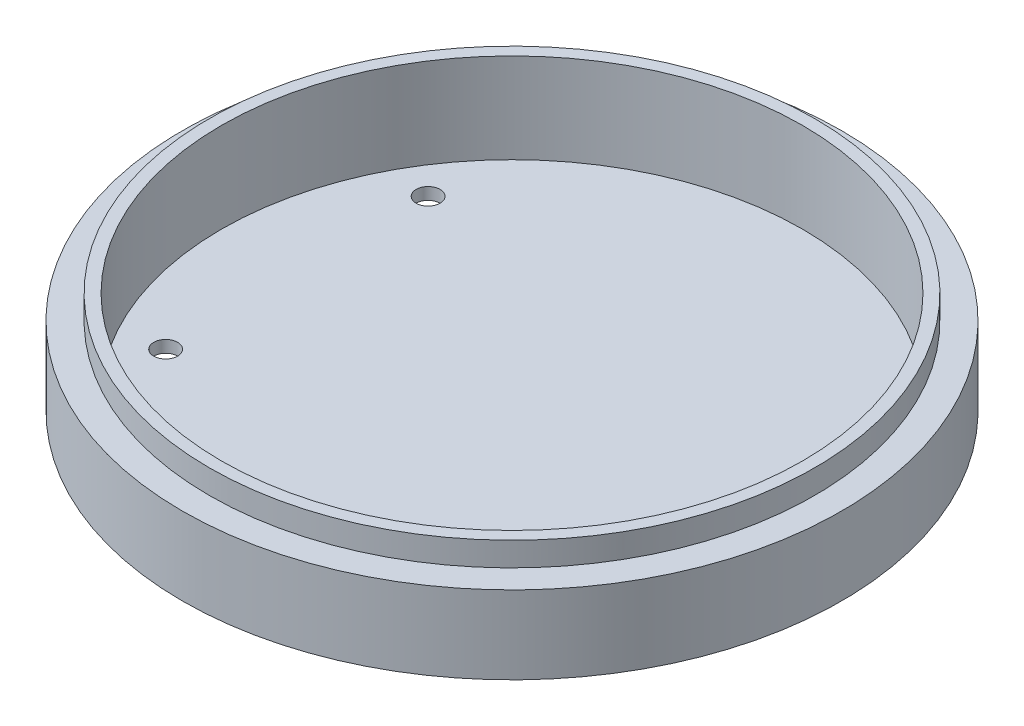
from build123d import *

# Parameters (mm, degrees)
SKETCH2_R           = 55
BOSS_EXTRUDE2_DEPTH = 13
SKETCH7_R           = 50.5
BOSS_EXTRUDE3_DEPTH = 4
SKETCH8_R           = 48.5
CUT_EXTRUDE3_DEPTH  = 15
SKETCH9_R           = 2
CUT_EXTRUDE4_DEPTH  = 15


with BuildPart() as part:
    # Sketch2 → Boss-Extrude2 (new body)
    with BuildSketch(Plane(origin=(0, 0, 0), x_dir=(1, 0, 0), z_dir=(0, 1, 0))):
        with Locations(Location((0, 0, 0), (0, 0, 90))):
            Circle(SKETCH2_R)
    extrude(amount=BOSS_EXTRUDE2_DEPTH)

    # Sketch7 → Boss-Extrude3 (add)
    with BuildSketch(Plane(origin=(0, 13, 0), x_dir=(1, 0, 0), z_dir=(0, 1, 0))):
        with Locations(Location((0, 0, 0), (0, 0, 270))):
            Circle(SKETCH7_R)
    extrude(amount=BOSS_EXTRUDE3_DEPTH)

    # Sketch8 → Cut-Extrude3 (cut)
    with BuildSketch(Plane(origin=(0, 17, 0), x_dir=(1, 0, 0), z_dir=(0, 1, 0))):
        with Locations(Location((0, 0, 0), (0, 0, 270))):
            Circle(SKETCH8_R)
    extrude(amount=-CUT_EXTRUDE3_DEPTH, mode=Mode.SUBTRACT)

    # Sketch9 → Cut-Extrude4 (cut)
    with BuildSketch(Plane(origin=(0, 2, 0), x_dir=(1, 0, 0), z_dir=(0, 1, 0))):
        with Locations(Location((36, -22, 0), (0, 0, 270))):
            Circle(SKETCH9_R)
        with Locations(Location((-36, 22, 0), (0, 0, 270))):
            Circle(SKETCH9_R)
        with Locations(Location((-35.8, -22, 0), (0, 0, 270))):
            Circle(SKETCH9_R)
        with Locations(Location((36, 22, 0), (0, 0, 270))):
            Circle(SKETCH9_R)
    extrude(amount=-CUT_EXTRUDE4_DEPTH, mode=Mode.SUBTRACT)


solid = part.part
